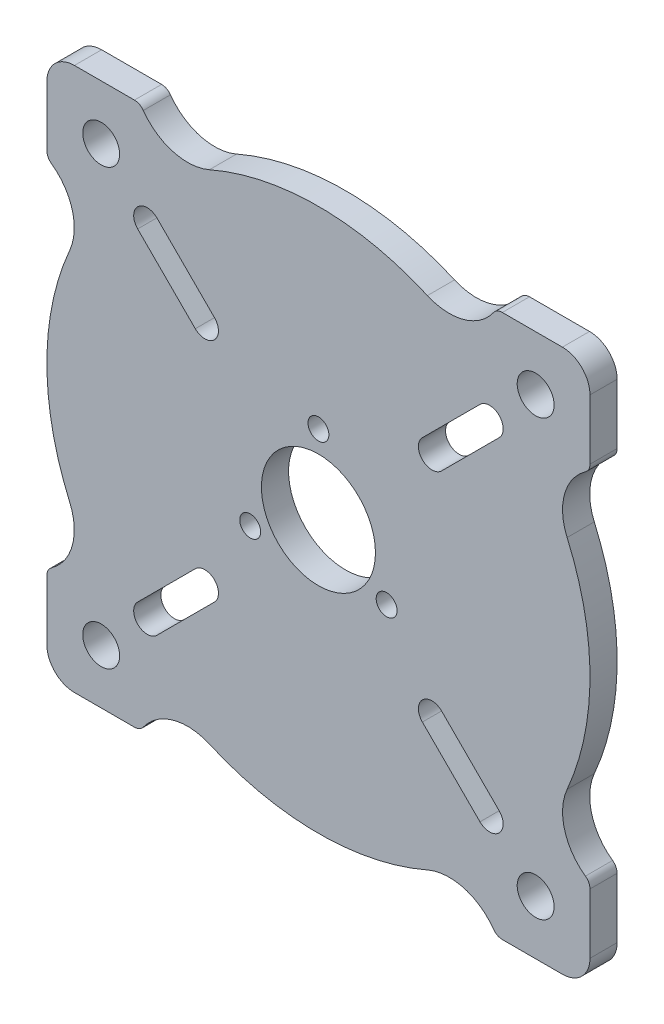
from build123d import *

# Parameters (mm, degrees)
ESQUISSE1_R        = 10.5
ESQUISSE1_R_2      = 3.4
ESQUISSE1_R_3      = 1.925
BOSS_EXTRU_2_DEPTH = 5


with BuildPart() as part:
    # Esquisse1 → Boss.-Extru.2 (new body)
    with BuildSketch(Plane.XY):
        with BuildLine():
            Line((50, -44.919487431), (50, -33.862050579))
            ThreePointArc((50, -33.862050579), (49.777389032, -32.945051), (49.159111773, -32.232185585))
            ThreePointArc((49.159111773, -32.232185585), (45.31641316, -26.748192273), (45.795558863, -20.069050512))
            ThreePointArc((45.795558863, -20.069050512), (48.937602838, -10.252366967), (50, 0))
            ThreePointArc((50, 0), (48.936869799, 10.255865358), (45.79268903, 20.075597908))
            ThreePointArc((45.79268903, 20.075597908), (45.313248124, 26.757056992), (49.158537806, 32.242082639))
            ThreePointArc((49.158537806, 32.242082639), (49.777227562, 32.955043184), (50, 33.872355669))
            Line((50, 33.872355669), (50, 44.919487431))
            ThreePointArc((50, 44.919487431), (48.51195232, 48.51195232), (44.919487431, 50))
            Line((44.919487431, 50), (33.862050579, 50))
            ThreePointArc((33.862050579, 50), (32.945051, 49.777389032), (32.232185585, 49.159111773))
            ThreePointArc((32.232185585, 49.159111773), (26.748192273, 45.31641316), (20.069050512, 45.795558863))
            ThreePointArc((20.069050512, 45.795558863), (10.252366967, 48.937602838), (0, 50))
            ThreePointArc((0, 50), (-10.255865358, 48.936869799), (-20.075597908, 45.79268903))
            ThreePointArc((-20.075597908, 45.79268903), (-26.757056992, 45.313248124), (-32.242082639, 49.158537806))
            ThreePointArc((-32.242082639, 49.158537806), (-32.955043184, 49.777227562), (-33.872355669, 50))
            Line((-33.872355669, 50), (-44.919487431, 50))
            ThreePointArc((-44.919487431, 50), (-48.51195232, 48.51195232), (-50, 44.919487431))
            Line((-50, 44.919487431), (-50, 33.862050579))
            ThreePointArc((-50, 33.862050579), (-49.777389032, 32.945051), (-49.159111773, 32.232185585))
            ThreePointArc((-49.159111773, 32.232185585), (-45.31641316, 26.748192273), (-45.795558863, 20.069050512))
            ThreePointArc((-45.795558863, 20.069050512), (-48.937602838, 10.252366967), (-50, 0))
            ThreePointArc((-50, 0), (-48.936869799, -10.255865358), (-45.79268903, -20.075597908))
            ThreePointArc((-45.79268903, -20.075597908), (-45.313248124, -26.757056992), (-49.158537806, -32.242082639))
            ThreePointArc((-49.158537806, -32.242082639), (-49.777227562, -32.955043184), (-50, -33.872355669))
            Line((-50, -33.872355669), (-50, -44.919487431))
            ThreePointArc((-50, -44.919487431), (-48.51195232, -48.51195232), (-44.919487431, -50))
            Line((-44.919487431, -50), (-33.862050579, -50))
            ThreePointArc((-33.862050579, -50), (-32.945051, -49.777389032), (-32.232185585, -49.159111773))
            ThreePointArc((-32.232185585, -49.159111773), (-26.748192273, -45.31641316), (-20.069050512, -45.795558863))
            ThreePointArc((-20.069050512, -45.795558863), (-10.252366967, -48.937602838), (0, -50))
            ThreePointArc((0, -50), (10.255865358, -48.936869799), (20.075597908, -45.79268903))
            ThreePointArc((20.075597908, -45.79268903), (26.757056992, -45.313248124), (32.242082639, -49.158537806))
            ThreePointArc((32.242082639, -49.158537806), (32.955043184, -49.777227562), (33.872355669, -50))
            Line((33.872355669, -50), (44.919487431, -50))
            ThreePointArc((44.919487431, -50), (48.51195232, -48.51195232), (50, -44.919487431))
        make_face()
        Circle(ESQUISSE1_R, mode=Mode.SUBTRACT)
        with Locations((40, -40)):
            Circle(ESQUISSE1_R_2, mode=Mode.SUBTRACT)
        with Locations((-40, -40)):
            Circle(ESQUISSE1_R_2, mode=Mode.SUBTRACT)
        with Locations((0, 14.5)):
            Circle(ESQUISSE1_R_3, mode=Mode.SUBTRACT)
        with Locations((40, 40)):
            Circle(ESQUISSE1_R_2, mode=Mode.SUBTRACT)
        with Locations((-40, 40)):
            Circle(ESQUISSE1_R_2, mode=Mode.SUBTRACT)
        with Locations((12.557368355, -7.25)):
            Circle(ESQUISSE1_R_3, mode=Mode.SUBTRACT)
        with Locations((-12.557368355, -7.25)):
            Circle(ESQUISSE1_R_3, mode=Mode.SUBTRACT)
        with BuildLine():
            Line((29.746951244, -33.28248515), (19.14034941, -22.675883316))
            ThreePointArc((19.14034941, -22.675883316), (19.14034941, -19.14034941), (22.675883316, -19.14034941))
            Line((22.675883316, -19.14034941), (33.282485034, -29.746951128))
            ThreePointArc((33.282485034, -29.746951128), (33.282485209, -33.282485092), (29.746951244, -33.28248515))
        make_face(mode=Mode.SUBTRACT)
        with BuildLine():
            Line((-33.28248515, -29.746951244), (-22.675883316, -19.14034941))
            ThreePointArc((-22.675883316, -19.14034941), (-19.14034941, -19.14034941), (-19.14034941, -22.675883316))
            Line((-19.14034941, -22.675883316), (-29.746951128, -33.282485034))
            ThreePointArc((-29.746951128, -33.282485034), (-33.282485092, -33.282485209), (-33.28248515, -29.746951244))
        make_face(mode=Mode.SUBTRACT)
        with BuildLine():
            Line((33.28248515, 29.746951244), (22.675883316, 19.14034941))
            ThreePointArc((22.675883316, 19.14034941), (19.14034941, 19.14034941), (19.14034941, 22.675883316))
            Line((19.14034941, 22.675883316), (29.746951128, 33.282485034))
            ThreePointArc((29.746951128, 33.282485034), (33.282485092, 33.282485209), (33.28248515, 29.746951244))
        make_face(mode=Mode.SUBTRACT)
        with BuildLine():
            Line((-29.746951244, 33.28248515), (-19.14034941, 22.675883316))
            ThreePointArc((-19.14034941, 22.675883316), (-19.14034941, 19.14034941), (-22.675883316, 19.14034941))
            Line((-22.675883316, 19.14034941), (-33.282485034, 29.746951128))
            ThreePointArc((-33.282485034, 29.746951128), (-33.282485209, 33.282485092), (-29.746951244, 33.28248515))
        make_face(mode=Mode.SUBTRACT)
    extrude(amount=BOSS_EXTRU_2_DEPTH)


solid = part.part
